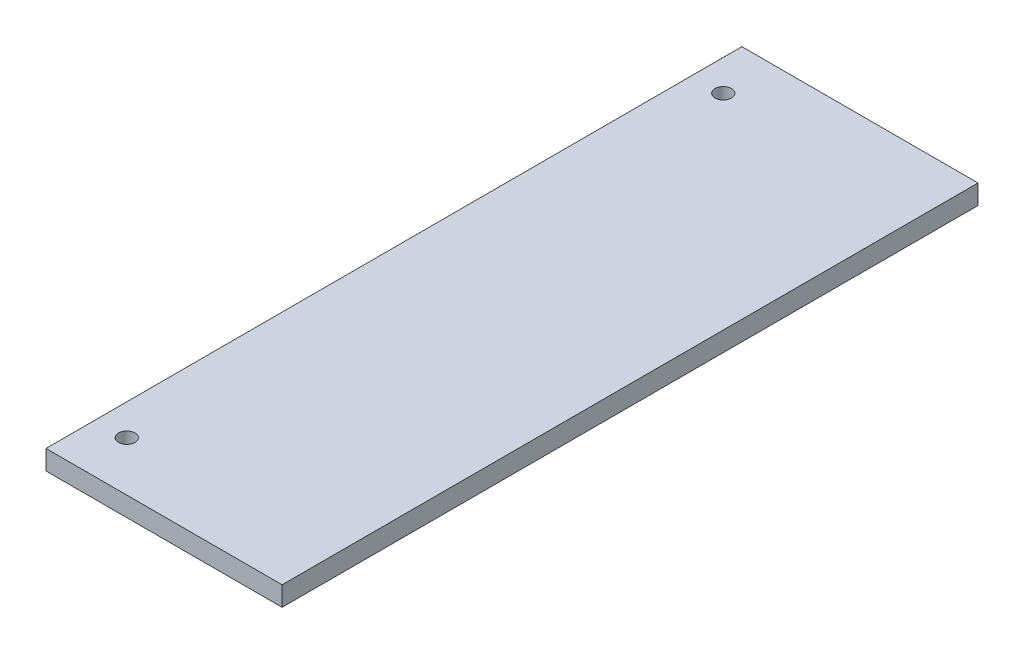
from build123d import *

# Parameters (mm, degrees)
SKETCH1_W           = 30.1625
SKETCH1_H           = 88.9
BOSS_EXTRUDE1_DEPTH = 2.5
SKETCH2_R           = 1.05
CUT_EXTRUDE1_DEPTH  = 48.005282698


with BuildPart() as part:
    # Sketch1 → Boss-Extrude1 (new body)
    with BuildSketch(Plane(origin=(0, 0, 0), x_dir=(1, 0, 0), z_dir=(0, 1, 0))):
        Rectangle(SKETCH1_W, SKETCH1_H)
    extrude(amount=BOSS_EXTRUDE1_DEPTH)

    # Sketch2 → Cut-Extrude1 (cut, through all)
    with BuildSketch(Plane(origin=(0, 2.5, 0), x_dir=(1, 0, 0), z_dir=(0, 1, 0))):
        with Locations(Location((-11.1125, 38.1, 0), (0, 0, 270))):
            Circle(SKETCH2_R)
        with Locations(Location((-11.1125, -38.1, 0), (0, 0, 270))):
            Circle(SKETCH2_R)
    extrude(amount=-CUT_EXTRUDE1_DEPTH, mode=Mode.SUBTRACT)


solid = part.part
